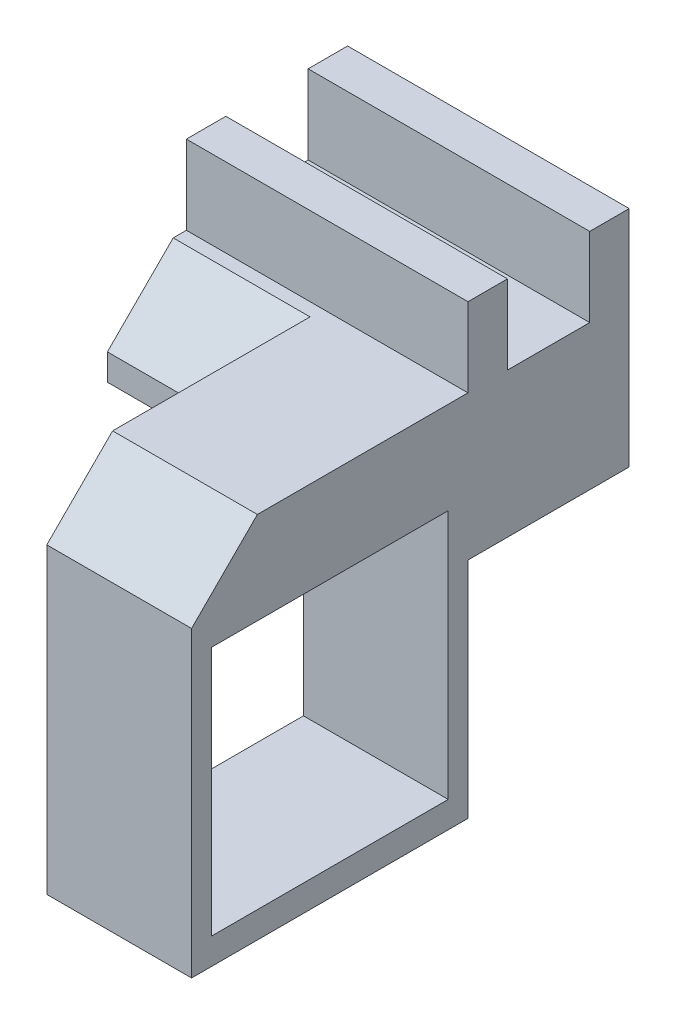
from build123d import *

# Parameters (mm, degrees)
BOSS_EXTRUDE2_DEPTH   = 23
SKETCH1_W             = 20.789980378
SKETCH1_H             = 6
BOSS_EXTRUDE2_2_DEPTH = 23
BOSS_EXTRUDE2_3_DEPTH = 23
BOSS_EXTRUDE2_4_DEPTH = 23
SKETCH1_3_W           = 20.789980378
SKETCH1_3_H           = 36.5
BOSS_EXTRUDE3_DEPTH   = 11
BOSS_EXTRUDE5_DEPTH   = 45
SKETCH2_W             = 9
SKETCH2_H             = 8
CUT_EXTRUDE1_DEPTH    = 106.353028551
SKETCH3_W             = 24.5
SKETCH3_H             = 11
BOSS_EXTRUDE6_DEPTH   = 42
BOSS_EXTRUDE7_DEPTH   = 11
CHAMFER2_SIZE         = 10
SKETCH5_W             = 20.789980378
SKETCH5_H             = 34
CUT_EXTRUDE2_DEPTH    = 104.008391914
SKETCH6_W             = 6
SKETCH6_H             = 12
BOSS_EXTRUDE8_DEPTH   = 22


with BuildPart() as part:
    # Sketch1 → Boss-Extrude2 (new body)
    with BuildSketch(Plane(origin=(0, 0, 0), x_dir=(1, 0, 0), z_dir=(0, 1, 0))):
        Polygon((0.945063883, 6), (0.945063883, 0), (1.890127766, 0), (21.735044261, 0), (21.735044261, 6), align=None)
    extrude(amount=BOSS_EXTRUDE2_DEPTH)



with BuildPart() as body_2:
    # Sketch1 → Boss-Extrude2 2 (new body)
    with BuildSketch(Plane(origin=(0, 0, 0), x_dir=(1, 0, 0), z_dir=(0, 1, 0))):
        with Locations((11.340054072, -15.5)):
            Rectangle(SKETCH1_W, SKETCH1_H)
    extrude(amount=BOSS_EXTRUDE2_2_DEPTH)


with BuildPart() as body_3:
    # Sketch1 → Boss-Extrude2 3 (new body)
    with BuildSketch(Plane(origin=(0, 0, 0), x_dir=(1, 0, 0), z_dir=(0, 1, 0))):
        with Locations((54.13003445, -15.5)):
            Rectangle(SKETCH1_W, SKETCH1_H)
    extrude(amount=BOSS_EXTRUDE2_3_DEPTH)


with BuildPart() as body_4:
    # Sketch1 → Boss-Extrude2 4 (new body)
    with BuildSketch(Plane(origin=(0, 0, 0), x_dir=(1, 0, 0), z_dir=(0, 1, 0))):
        with Locations((54.13003445, 3)):
            Rectangle(SKETCH1_W, SKETCH1_H)
    extrude(amount=BOSS_EXTRUDE2_4_DEPTH)


with BuildPart() as part_1:
    add(part.part)

    add(body_2.part)  # Boss-Extrude3 merges body 2
    # Sketch1<3> → Boss-Extrude3 (add)
    with BuildSketch(Plane(origin=(0, 0, 0), x_dir=(1, 0, 0), z_dir=(0, 1, 0))):
        with Locations((11.340054072, -12.25)):
            Rectangle(SKETCH1_3_W, SKETCH1_3_H)
        with Locations((54.13003445, -12.25)):
            Rectangle(SKETCH1_3_W, SKETCH1_3_H)
    extrude(amount=-BOSS_EXTRUDE3_DEPTH)

    # Sketch1<6> → Boss-Extrude5 (add)
    with BuildSketch(Plane(origin=(0, 0, 0), x_dir=(1, 0, 0), z_dir=(0, 1, 0))):
        Polygon((43.735044261, -18.5), (32.735044261, -18.5), (32.735044261, -60.5), (43.735044261, -60.5), (43.735044261, -30.5), align=None)
        Polygon((32.735044261, -18.5), (21.735044261, -18.5), (21.735044261, -30.5), (21.735044261, -60.5), (32.735044261, -60.5), align=None)
    extrude(amount=-BOSS_EXTRUDE5_DEPTH)

    # Sketch2 → Cut-Extrude1 (cut, through all)
    with BuildSketch(Plane(origin=(74.525024639, 0, 0), x_dir=(0, 0, -1), z_dir=(1, 0, 0))):
        Polygon((-30.5, -11), (-30.5, -3), (-41.183889214, -3), (-57.5, -3), (-57.5, -14.989659462), (-57.5, -41), (-21.5, -41), (-21.5, -11), align=None)
        with Locations((-26, -7)):
            Rectangle(SKETCH2_W, SKETCH2_H)
    extrude(amount=-CUT_EXTRUDE1_DEPTH, mode=Mode.SUBTRACT)


    add(body_3.part)  # Boss-Extrude6 merges body 3

    add(body_4.part)  # Boss-Extrude6 merges body 4
    # Sketch3 → Boss-Extrude6 (add)
    with BuildSketch(Plane.ZY.offset(-43.735044261)):
        with Locations((6.25, -5.5)):
            Rectangle(SKETCH3_W, SKETCH3_H)
    extrude(amount=BOSS_EXTRUDE6_DEPTH)

    # Sketch4 → Boss-Extrude7 (add)
    with BuildSketch(Plane(origin=(0, 0, 0), x_dir=(1, 0, 0), z_dir=(0, 1, 0))):
        Polygon((64.525024639, -18.5), (43.735044261, -18.5), (43.735044261, -12.5), (64.525024639, -12.5), (64.525024639, 0), (43.735044261, 0), (43.735044261, 6), (21.735044261, 6), (21.735044261, 0), (0.945063883, 0), (0.945063883, -12.5), (21.735044261, -12.5), (21.735044261, -18.5), (0.945063883, -18.5), (0.945063883, -30.5), (21.735044261, -30.5), (21.735044261, -60.5), (43.735044261, -60.5), (43.735044261, -30.5), (64.525024639, -30.5), align=None)
    extrude(amount=BOSS_EXTRUDE7_DEPTH)

    # Chamfer2
    chamfer2_edges = [part_1.edges().sort_by_distance(p)[0] for p in [
        (11.340054072, 11, 30.5),
        (32.735044261, 11, 60.5),
        (54.13003445, 11, 30.5),
    ]]
    chamfer(chamfer2_edges, length=CHAMFER2_SIZE)

    # Sketch5 → Cut-Extrude2 (cut, through all)
    with BuildSketch(Plane(origin=(0, 0, -6), x_dir=(-1, 0, 0), z_dir=(0, 0, -1))):
        with Locations((-54.13003445, 6)):
            Rectangle(SKETCH5_W, SKETCH5_H)
    extrude(amount=-CUT_EXTRUDE2_DEPTH, mode=Mode.SUBTRACT)

    # Sketch6 → Boss-Extrude8 (add)
    with BuildSketch(Plane(origin=(21.735044261, 0, 0), x_dir=(0, 0, -1), z_dir=(1, 0, 0))):
        with Locations((-15.5, 17)):
            Rectangle(SKETCH6_W, SKETCH6_H)
        with Locations((3, 17)):
            Rectangle(SKETCH6_W, SKETCH6_H)
    extrude(amount=BOSS_EXTRUDE8_DEPTH)


solid = part_1.part
